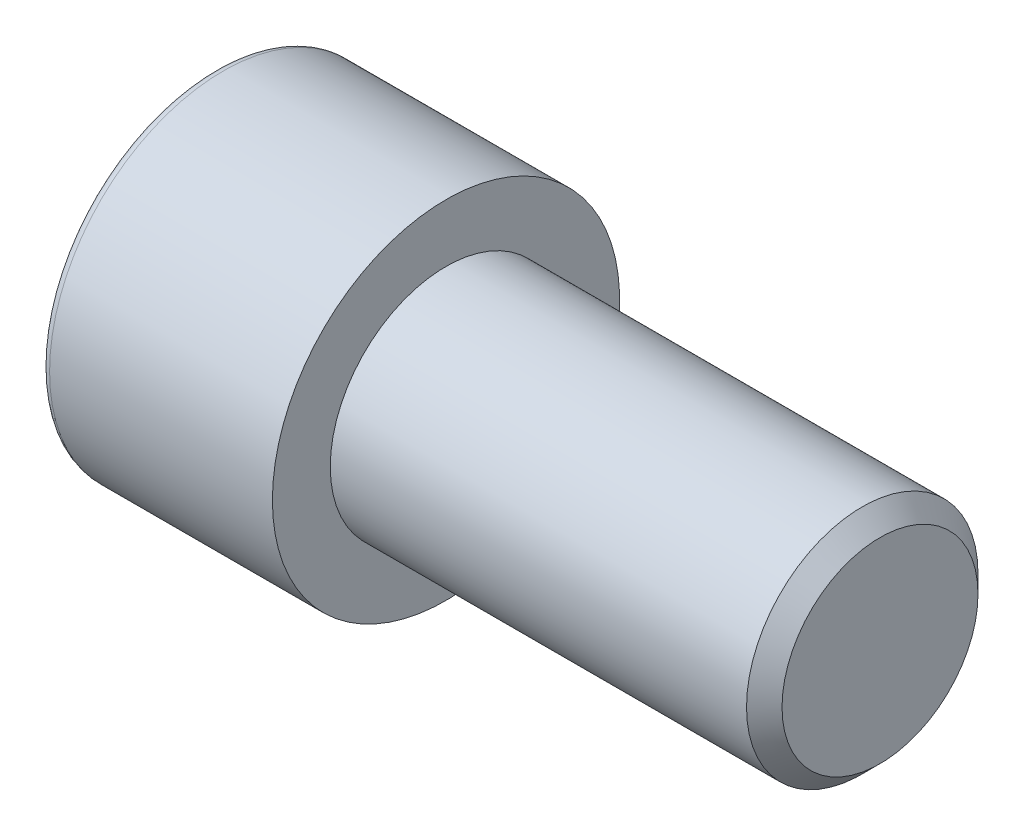
from build123d import *

# Parameters (mm, degrees)
SZKIC1_W                    = 16
SZKIC1_H                    = 12
SZKIC5_R                    = 9
DODANIE_WYCI_GNI_CIE1_DEPTH = 12


with BuildPart() as part:
    # Szkic1 → Obrót1 (revolve)
    with BuildSketch(Plane.XY):
        with Locations((8, 6)):
            Rectangle(SZKIC1_W, SZKIC1_H)
    revolve(axis=Axis((16, 0, 0), (-1, 0, 0)))

    # Szkic2 → Wycięcie-obrót1 (revolve, cut)
    with BuildSketch(Plane.XY):
        with BuildLine():
            Line((0, 12), (0, 11.4))
            ThreePointArc((0, 11.4), (0.175735931, 11.824264069), (0.6, 12))
            Line((0.6, 12), (0, 12))
        make_face()
    revolve(axis=Axis((16, 0, 0), (-1, 0, 0)), mode=Mode.SUBTRACT)

    # Szkic3 → Obrót2 (revolve)
    with BuildSketch(Plane.XY):
        Polygon((16, 0), (16, 8), (44.773, 8), (46, 6.773), (46, 0), align=None)
    revolve(axis=Axis((46, 0, 0), (-1, 0, 0)))

    # Szkic4 → Wycięcie-obrót2 (revolve, cut)
    with BuildSketch(Plane.XY):
        Polygon((0, 0), (0, 8.5), (8, 8.5), (12.907477288, 0), align=None)
    revolve(axis=Axis((12.907477288, 0, 0), (-1, 0, 0)), mode=Mode.SUBTRACT)

    # Szkic5 → Dodanie-wyciągnięcie1 (add)
    with BuildSketch(Plane(origin=(0, 0, 0), x_dir=(0, 0, -1), z_dir=(1, 0, 0))):
        Circle(SZKIC5_R)
        Polygon((-7, 4.041451884), (-7, -4.041451884), (0, -8.082903769), (7, -4.041451884), (7, 4.041451884), (0, 8.082903769), align=None, mode=Mode.SUBTRACT)
    extrude(amount=DODANIE_WYCI_GNI_CIE1_DEPTH)


solid = part.part
